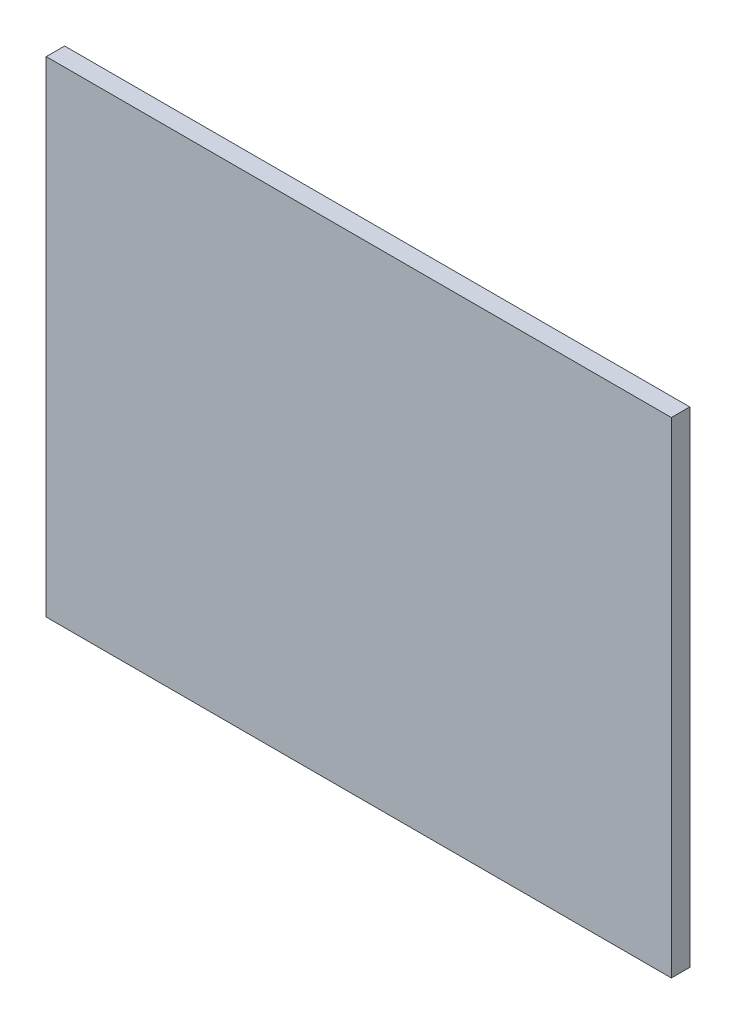
from build123d import *

# Parameters (mm, degrees)
SKETCH1_W           = 85
SKETCH1_H           = 66
BOSS_EXTRUDE1_DEPTH = 2.5


with BuildPart() as part:
    # Sketch1 → Boss-Extrude1 (new body)
    with BuildSketch(Plane.XY):
        with Locations((3.069230769, 3.384615385)):
            Rectangle(SKETCH1_W, SKETCH1_H)
    extrude(amount=BOSS_EXTRUDE1_DEPTH)


solid = part.part
